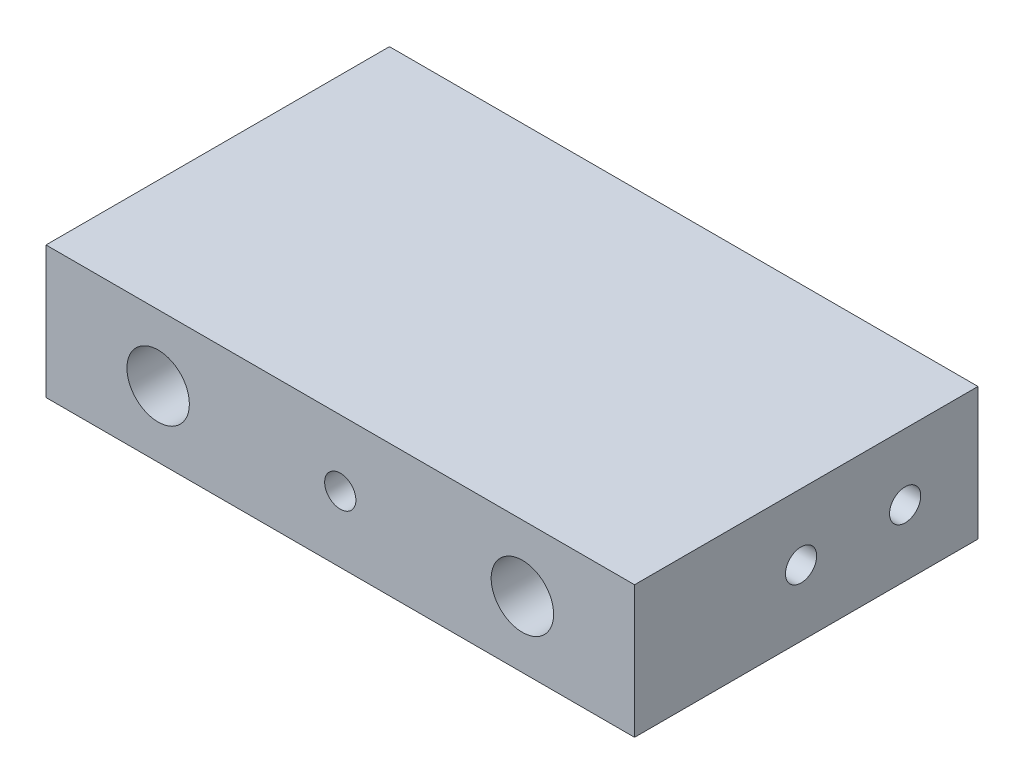
from build123d import *

# Parameters (mm, degrees)
SKETCH1_W           = 56.55
SKETCH1_H           = 12.7
BOSS_EXTRUDE1_DEPTH = 33
SKETCH2_R           = 1.5
CUT_EXTRUDE1_DEPTH  = 10
CUT_EXTRUDE2_DEPTH  = 66.781646376


with BuildPart() as part:
    # Sketch1 → Boss-Extrude1 (new body)
    with BuildSketch(Plane.XY):
        Rectangle(SKETCH1_W, SKETCH1_H)
    extrude(amount=BOSS_EXTRUDE1_DEPTH)

    # Sketch2 → Cut-Extrude1 (cut)
    with BuildSketch(Plane.XY.offset(33)):
        with BuildLine():
            Line((-20.5, 0), (-17.5, 0))
            Line((-17.5, 0), (-14.5, 0))
            ThreePointArc((-14.5, 0), (-17.5, 3), (-20.5, 0))
        make_face()
        with BuildLine():
            Line((-14.5, 0), (-17.5, 0))
            Line((-17.5, 0), (-20.5, 0))
            ThreePointArc((-20.5, 0), (-17.5, -3), (-14.5, 0))
        make_face()
        with BuildLine():
            ThreePointArc((20.5, 0), (17.5, 3), (14.5, 0))
            Line((14.5, 0), (17.5, 0))
            Line((17.5, 0), (20.5, 0))
        make_face()
        with BuildLine():
            Line((17.5, 0), (14.5, 0))
            ThreePointArc((14.5, 0), (17.5, -3), (20.5, 0))
            Line((20.5, 0), (17.5, 0))
        make_face()
        Circle(SKETCH2_R)
    extrude(amount=-CUT_EXTRUDE1_DEPTH, mode=Mode.SUBTRACT)

    # Sketch3 → Cut-Extrude2 (cut, through all)
    with BuildSketch(Plane.ZY.offset(28.275)):
        with BuildLine():
            ThreePointArc((5.5, 0), (7, -1.5), (8.5, 0))
            Line((8.5, 0), (5.5, 0))
        make_face()
        with BuildLine():
            Line((5.5, 0), (8.5, 0))
            ThreePointArc((8.5, 0), (7, 1.5), (5.5, 0))
        make_face()
        with BuildLine():
            ThreePointArc((15.5, 0), (17, -1.5), (18.5, 0))
            Line((18.5, 0), (15.5, 0))
        make_face()
        with BuildLine():
            Line((15.5, 0), (18.5, 0))
            ThreePointArc((18.5, 0), (17, 1.5), (15.5, 0))
        make_face()
    extrude(amount=-CUT_EXTRUDE2_DEPTH, mode=Mode.SUBTRACT)


solid = part.part
